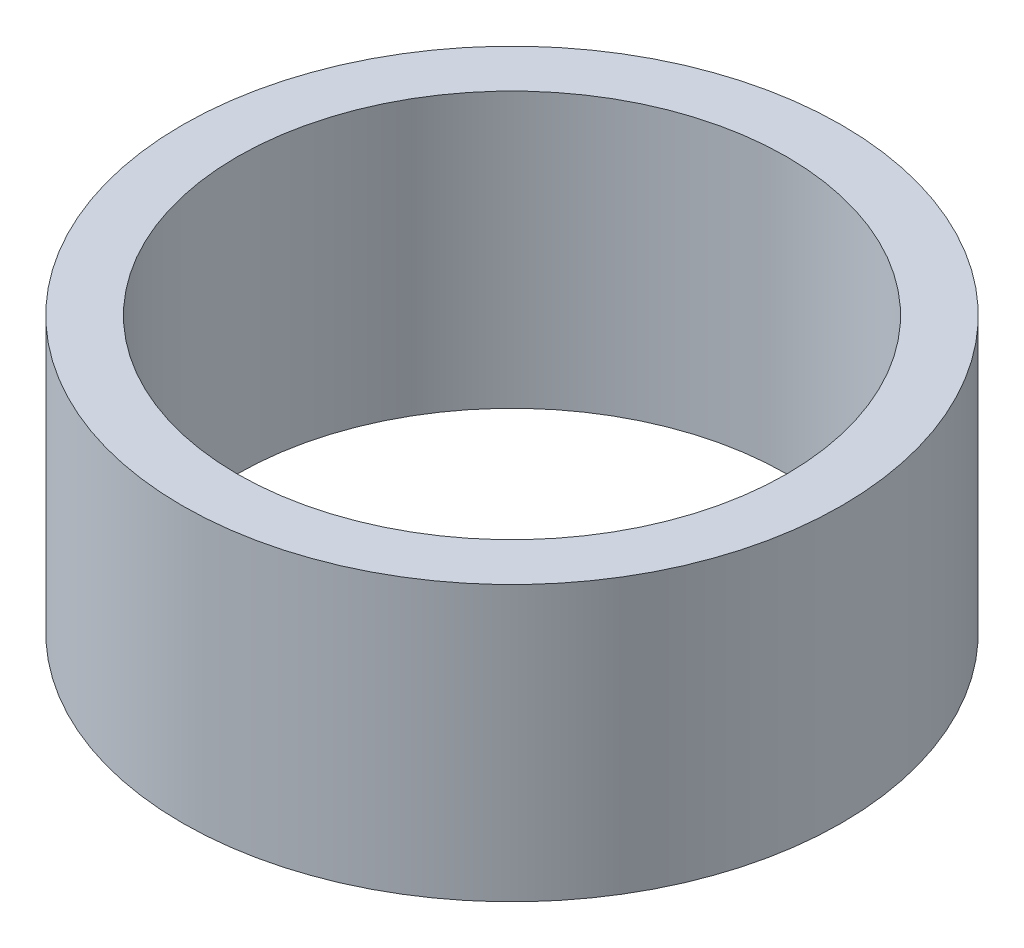
from build123d import *

# Parameters (mm, degrees)
SKETCH_1_R      = 6
SKETCH_1_R_2    = 5
EXTRUDE_1_DEPTH = 5


with BuildPart() as part:
    # Эскиз1 → Бобышка-Вытянуть1 (new body)
    with BuildSketch(Plane(origin=(0, 0, 0), x_dir=(1, 0, 0), z_dir=(0, 1, 0))):
        with Locations(Location((-2.129556382, 0.831402149, 0), (0, 0, 270))):
            Circle(SKETCH_1_R)
        with Locations(Location((-2.129556382, 0.831402149, 0), (0, 0, 270))):
            Circle(SKETCH_1_R_2, mode=Mode.SUBTRACT)
    extrude(amount=EXTRUDE_1_DEPTH)


solid = part.part
